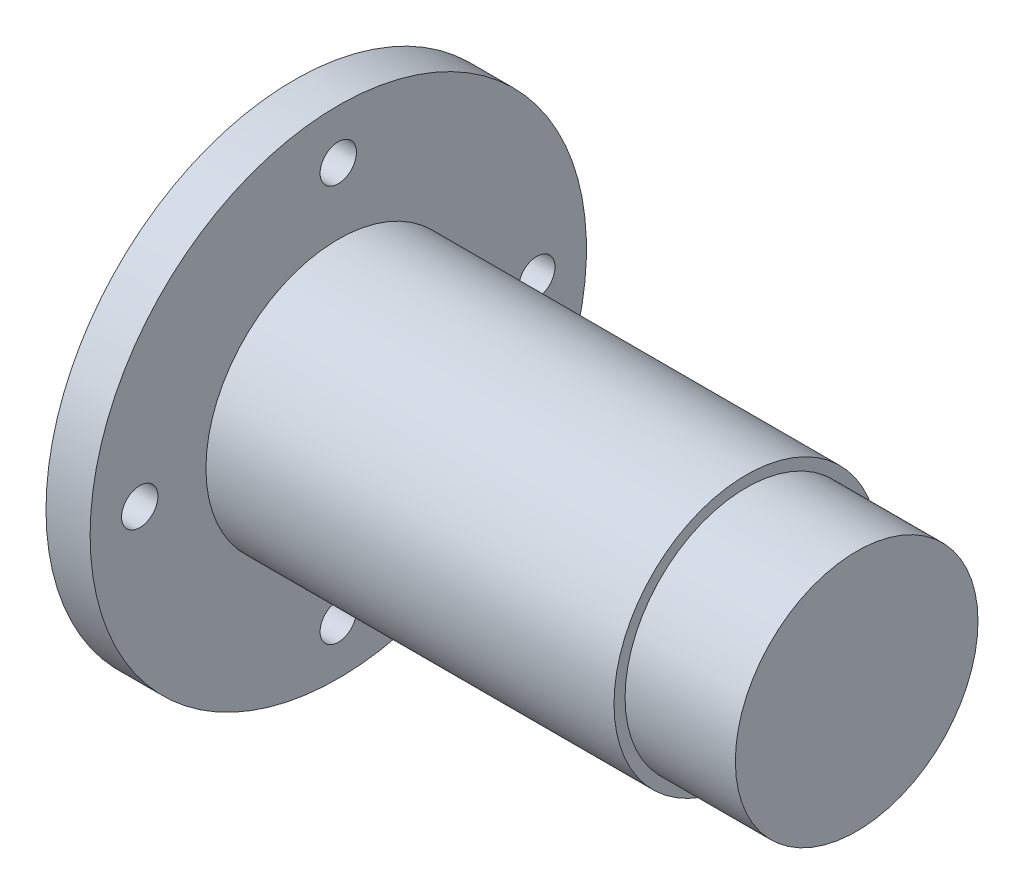
from build123d import *

# Parameters (mm, degrees)
SKETCH_1_W                  = 31
SKETCH_1_H                  = 2
SKETCH_6_R                  = 22.5
SKETCH_6_R_2                = 12
EXTRUDE_1_DEPTH             = 4
SKETCH_8_R                  = 12
SKETCH_8_R_2                = 10
EXTRUDE_3_DEPTH             = 10
SKETCH_9_R                  = 12
EXTRUDE_5_DEPTH             = 10
SKETCH_18_R                 = 10
CUT_EXTRUDE_1_DEPTH         = 46
SKETCH_17_W                 = 1.65
SKETCH_17_H                 = 51
HOLE_WIZARD_M4_1_AT_2_COUNT = 2
HOLE_WIZARD_M4_1_AT_2_PITCH = 25.455844123
HOLE_WIZARD_M4_1_AT_3_COUNT = 2
HOLE_WIZARD_M4_1_AT_3_PITCH = 36
HOLE_WIZARD_M4_1_AT_4_COUNT = 2
HOLE_WIZARD_M4_1_AT_4_PITCH = 25.455844123
SKETCH_12_W                 = 1
SKETCH_12_H                 = 2
SKETCH_19_R                 = 12
SKETCH_19_R_2               = 11
CUT_EXTRUDE_3_DEPTH         = 10


with BuildPart() as part:
    # 草图1 → 旋转1 (revolve)
    with BuildSketch(Plane.XY, mode=Mode.PRIVATE) as revolve_1_sk:
        with Locations((4.5, 11)):
            Rectangle(SKETCH_1_W, SKETCH_1_H)
    revolve(revolve_1_sk.sketch.rotate(Axis((-11, 0, 0), (1, 0, 0)), 90), axis=Axis((-11, 0, 0), (1, 0, 0)))

    # 草图5 → 切除-旋转1 (revolve, cut)
    with BuildSketch(Plane.XY):
        with BuildLine():
            Line((-11, 10.5), (-10.4, 10.5))
            ThreePointArc((-10.4, 10.5), (-10.046446609, 10.353553391), (-9.9, 10))
            Line((-9.9, 10), (-9.9, 11.8))
            ThreePointArc((-9.9, 11.8), (-10.046446609, 11.446446609), (-10.4, 11.3))
            Line((-10.4, 11.3), (-11, 11.3))
            Line((-11, 11.3), (-11, 10.5))
        make_face()
    revolve(axis=Axis((0, 0, 0), (-1, 0, 0)), mode=Mode.SUBTRACT)


with BuildPart() as cut_revolve_1_piece_1:
    # of the separate pieces the step leaves, piece 1, a body of its own (cut_revolve_1_pieces)
    add(part.part.solids().sort_by_distance((20, 0, 10))[0])

    # 草图6 → 凸台-拉伸1 (add)
    with BuildSketch(Plane.ZY.offset(11)):
        Circle(SKETCH_6_R)
        Circle(SKETCH_6_R_2, mode=Mode.SUBTRACT)
    extrude(amount=-EXTRUDE_1_DEPTH)

    # 草图8 → 凸台-拉伸3 (add)
    with BuildSketch(Plane(origin=(20, 0, 0), x_dir=(0, 0, -1), z_dir=(1, 0, 0))):
        with Locations(Location((0, 0, 0), (0, 0, 180))):
            Circle(SKETCH_8_R)
        with Locations(Location((0, 0, 0), (0, 0, 90))):
            Circle(SKETCH_8_R_2, mode=Mode.SUBTRACT)
    extrude(amount=EXTRUDE_3_DEPTH)

    # 草图17 → M4 螺纹孔1 (revolve, cut)
    with BuildSketch(Plane(origin=(-11, 18, 0), x_dir=(0, 0, 1), z_dir=(0, 1, 0))):
        with Locations((0.825, 25.5)):
            Rectangle(SKETCH_17_W, SKETCH_17_H)
    hole_wizard_m4_1 = revolve(axis=Axis((-17.35, 18, 0), (1, 0, 0)), mode=Mode.SUBTRACT)

    # M4 螺纹孔1 at 2: M4 螺纹孔1 ×2
    with Locations(*[Vector(0, -0.7071067811865476, 0.7071067811865476) * (i * HOLE_WIZARD_M4_1_AT_2_PITCH) for i in range(1, HOLE_WIZARD_M4_1_AT_2_COUNT)]):
        add(hole_wizard_m4_1, mode=Mode.SUBTRACT)

    # M4 螺纹孔1 at 3: M4 螺纹孔1 ×2
    with Locations(*[(0, -i * HOLE_WIZARD_M4_1_AT_3_PITCH, 0) for i in range(1, HOLE_WIZARD_M4_1_AT_3_COUNT)]):
        add(hole_wizard_m4_1, mode=Mode.SUBTRACT)

    # M4 螺纹孔1 at 4: M4 螺纹孔1 ×2
    with Locations(*[Vector(0, -0.7071067811865477, -0.7071067811865475) * (i * HOLE_WIZARD_M4_1_AT_4_PITCH) for i in range(1, HOLE_WIZARD_M4_1_AT_4_COUNT)]):
        add(hole_wizard_m4_1, mode=Mode.SUBTRACT)


with BuildPart() as cut_revolve_1_piece_2:
    # of the separate pieces the step leaves, piece 2, a body of its own (cut_revolve_1_pieces)
    add(part.part.solids().sort_by_distance((-11, 0, 10))[0])


with BuildPart() as body_3:
    # 草图9 → 凸台-拉伸5 (new body)
    with BuildSketch(Plane(origin=(30, 0, 0), x_dir=(0, 0, -1), z_dir=(1, 0, 0))):
        Circle(SKETCH_9_R)
    extrude(amount=EXTRUDE_5_DEPTH)

    # 草图18 → 切除-拉伸1 (cut)
    with BuildSketch(Plane(origin=(-7, 0, 0), x_dir=(0, 0, -1), z_dir=(1, 0, 0))):
        Circle(SKETCH_18_R)
    extrude(amount=CUT_EXTRUDE_1_DEPTH, mode=Mode.SUBTRACT)

    # 草图12 → 切除-旋转2 (revolve, cut)
    with BuildSketch(Plane.XY, mode=Mode.PRIVATE) as cut_revolve_2_sk:
        with Locations((33.5, -12)):
            Rectangle(SKETCH_12_W, SKETCH_12_H)
        with Locations((31.5, -12)):
            Rectangle(SKETCH_12_W, SKETCH_12_H)
        with Locations((35.5, -12)):
            Rectangle(SKETCH_12_W, SKETCH_12_H)
        with Locations((37.5, -12)):
            Rectangle(SKETCH_12_W, SKETCH_12_H)
        with Locations((39.5, -12)):
            Rectangle(SKETCH_12_W, SKETCH_12_H)
    revolve(cut_revolve_2_sk.sketch.rotate(Axis((0, 0, 0), (1, 0, 0)), 270), axis=Axis((0, 0, 0), (1, 0, 0)), mode=Mode.SUBTRACT)

    # 草图19 → 切除-拉伸3 (cut)
    with BuildSketch(Plane(origin=(40, 0, 0), x_dir=(0, 0, -1), z_dir=(1, 0, 0))):
        with Locations(Location((0, 0, 0), (0, 0, 180))):
            Circle(SKETCH_19_R)
        with Locations(Location((0, 0, 0), (0, 0, 180))):
            Circle(SKETCH_19_R_2, mode=Mode.SUBTRACT)
    extrude(amount=-CUT_EXTRUDE_3_DEPTH, mode=Mode.SUBTRACT)


solid = Compound([cut_revolve_1_piece_1.part, cut_revolve_1_piece_2.part, body_3.part])
